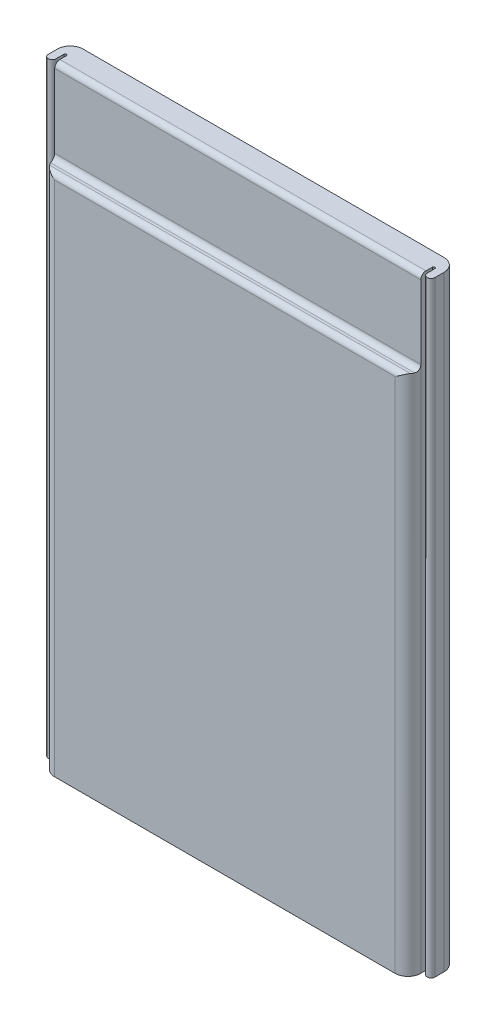
from build123d import *

# Parameters (mm, degrees)
EXTRUDE_1_DEPTH                 = 23.5
CUT_EXTRUDE_1_REACH             = 30.04
CUT_EXTRUDE_1_DIRECTION_2_REACH = 30.04


with BuildPart() as part:
    # Эскиз1 → Бобышка-Вытянуть1 (new, symmetric)
    with BuildSketch(Plane(origin=(0, 0, 0), x_dir=(1, 0, 0), z_dir=(0, 1, 0))):
        with BuildLine():
            Line((-14, 0), (14, 0))
            ThreePointArc((14, 0), (14.707106781, -0.292893219), (15, -1))
            Line((15, -1), (15, -1.7))
            ThreePointArc((15, -1.7), (14.7, -2), (14.4, -1.7))
            Line((14.4, -1.7), (14.4, -1.1))
            ThreePointArc((14.4, -1.1), (14.3, -1), (14.2, -1.1))
            Line((14.2, -1.1), (14.2, -2))
            ThreePointArc((14.2, -2), (13.907106781, -2.707106781), (13.2, -3))
            Line((13.2, -3), (-13.2, -3))
            ThreePointArc((-13.2, -3), (-13.907106781, -2.707106781), (-14.2, -2))
            Line((-14.2, -2), (-14.2, -1.1))
            ThreePointArc((-14.2, -1.1), (-14.3, -1), (-14.4, -1.1))
            Line((-14.4, -1.1), (-14.4, -1.7))
            ThreePointArc((-14.4, -1.7), (-14.7, -2), (-15, -1.7))
            Line((-15, -1.7), (-15, -1))
            ThreePointArc((-15, -1), (-14.707106781, -0.292893219), (-14, 0))
        make_face()
    extrude(amount=EXTRUDE_1_DEPTH, both=True)

    # Эскиз2 → Вырез-Вытянуть1 (cut, up to next)
    with BuildSketch(Plane(origin=(0, 0, 0), x_dir=(0, 0, -1), z_dir=(1, 0, 0)), mode=Mode.PRIVATE) as cut_extrude_1_sk1:
        with BuildLine():
            Line((-2, 23.1), (-2, 17.4))
            ThreePointArc((-2, 17.4), (-2.117157288, 17.117157288), (-2.4, 17))
            Line((-2.4, 17), (-2.6, 17))
            ThreePointArc((-2.6, 17), (-2.882842712, 16.882842712), (-3, 16.6))
            Line((-3, 16.6), (-3, 23.5))
            Line((-3, 23.5), (-1.6, 23.5))
            ThreePointArc((-1.6, 23.5), (-1.882842712, 23.382842712), (-2, 23.1))
        make_face()
    cut_extrude_1_tool1 = extrude(cut_extrude_1_sk1.sketch, amount=-CUT_EXTRUDE_1_REACH, mode=Mode.PRIVATE) & part.part
    add(cut_extrude_1_tool1.solids().sort_by_distance((0, 20.265669, 2.501219))[0], mode=Mode.SUBTRACT)

    # Эскиз2 → Вырез-Вытянуть1 direction 2 (cut, up to next)
    with BuildSketch(Plane(origin=(0, 0, 0), x_dir=(0, 0, -1), z_dir=(1, 0, 0)), mode=Mode.PRIVATE) as cut_extrude_1_direction_2_sk1:
        with BuildLine():
            Line((-2, 23.1), (-2, 17.4))
            ThreePointArc((-2, 17.4), (-2.117157288, 17.117157288), (-2.4, 17))
            Line((-2.4, 17), (-2.6, 17))
            ThreePointArc((-2.6, 17), (-2.882842712, 16.882842712), (-3, 16.6))
            Line((-3, 16.6), (-3, 23.5))
            Line((-3, 23.5), (-1.6, 23.5))
            ThreePointArc((-1.6, 23.5), (-1.882842712, 23.382842712), (-2, 23.1))
        make_face()
    cut_extrude_1_direction_2_tool1 = extrude(cut_extrude_1_direction_2_sk1.sketch, amount=CUT_EXTRUDE_1_DIRECTION_2_REACH, mode=Mode.PRIVATE) & part.part
    add(cut_extrude_1_direction_2_tool1.solids().sort_by_distance((0, 20.265669, 2.501219))[0], mode=Mode.SUBTRACT)


solid = part.part
